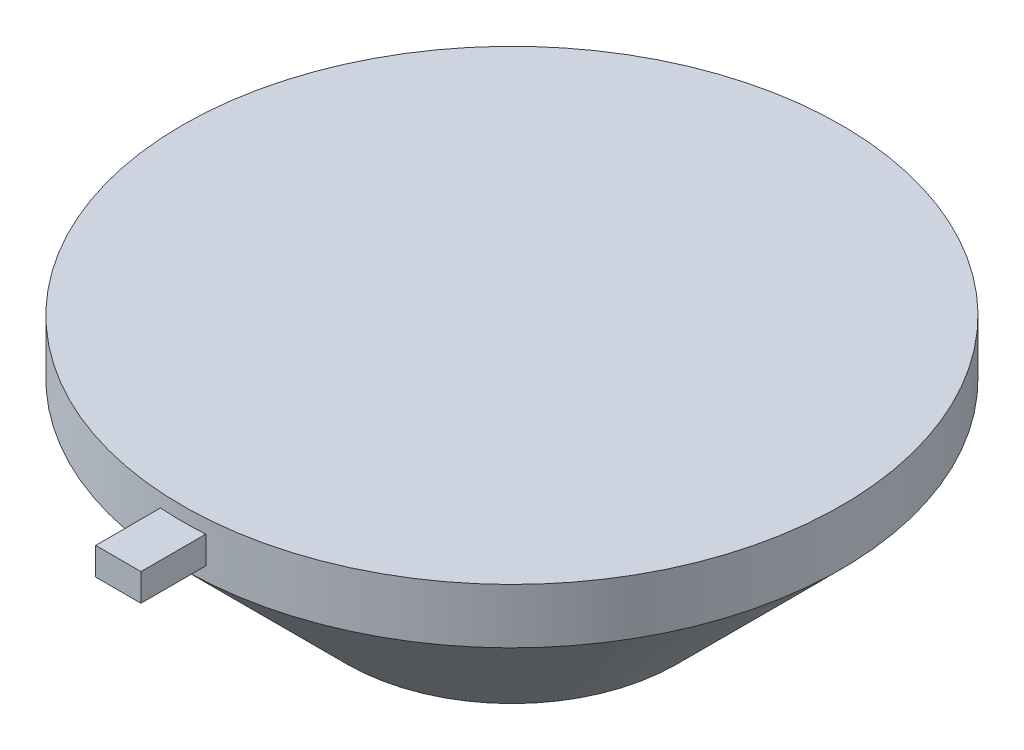
from build123d import *

# Parameters (mm, degrees)
SKETCH11_R          = 12
BOSS_EXTRUDE3_DEPTH = 2
BOSS_EXTRUDE4_START = -0.5
SKETCH12_W          = 1.649249379
SKETCH12_H          = 3.276759918
BOSS_EXTRUDE4_DEPTH = 1
SKETCH14_R          = 1
CUT_EXTRUDE2_DEPTH  = 2


with BuildPart() as part:
    # Sketch1 → Revolve1 (revolve)
    with BuildSketch(Plane.XY):
        Polygon((0.388993331, -0.067795133), (-5.226777212, -4), (6.321198199, -4), (6.321198199, 6), (-5.678801801, 6), align=None)
    revolve(axis=Axis((6.321198199, 11.047707555, 0), (0, -1, 0)))


with BuildPart() as body_2:
    # Split2: the piece on the far side of the plane
    add(part.part)
    split(bisect_by=Plane.ZX, keep=Keep.BOTTOM)


with BuildPart() as part_1:
    add(part.part)

    # Split2
    split(bisect_by=Plane.ZX, keep=Keep.TOP)

    # Sketch11 → Boss-Extrude3 (add)
    with BuildSketch(Plane(origin=(0, 6, 0), x_dir=(1, 0, 0), z_dir=(0, 1, 0))):
        with Locations(Location((6.321198199, 0, 0), (0, 0, 180))):
            Circle(SKETCH11_R)
    extrude(amount=BOSS_EXTRUDE3_DEPTH)

    # Sketch12 → Boss-Extrude4 (add)
    with BuildSketch(Plane(origin=(0, 8, 0), x_dir=(1, 0, 0), z_dir=(0, 1, 0)).offset(BOSS_EXTRUDE4_START)):
        with Locations((6.321198199, -12.693940914)):
            Rectangle(SKETCH12_W, SKETCH12_H)
    extrude(amount=-BOSS_EXTRUDE4_DEPTH)

    # Sketch14 → Cut-Extrude2 (cut)
    with BuildSketch(Plane(origin=(0, 0, 0), x_dir=(-1, 0, 0), z_dir=(0, -1, 0))):
        with Locations(Location((-6.546676473, 0, 0), (0, 0, 90))):
            Circle(SKETCH14_R)
    extrude(amount=-CUT_EXTRUDE2_DEPTH, mode=Mode.SUBTRACT)


solid = part_1.part
